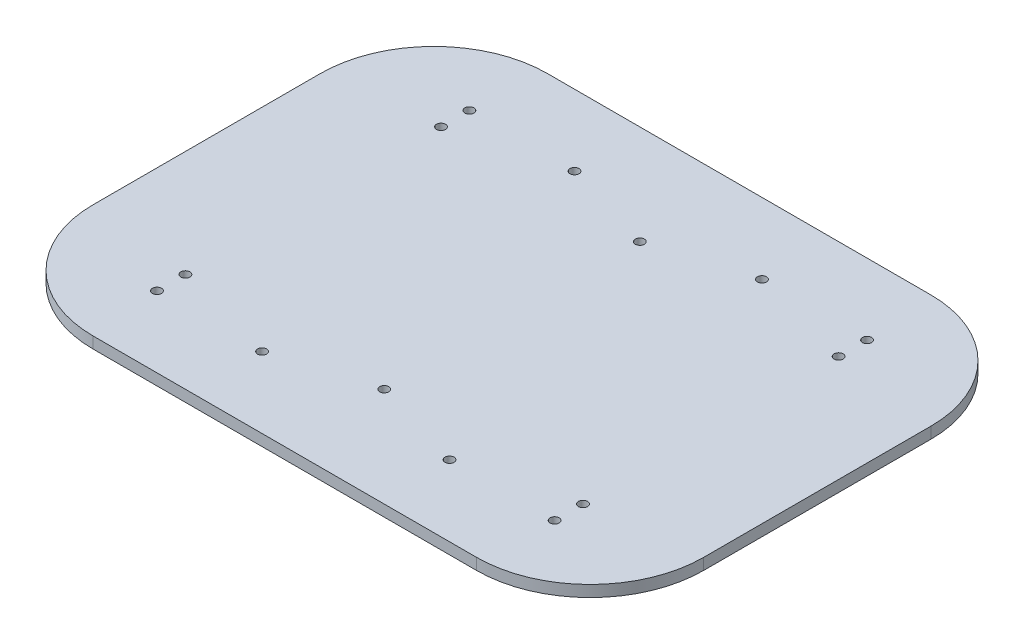
from build123d import *

# Parameters (mm, degrees)
SKETCH1_W                  = 215
SKETCH1_H                  = 160
BOSS_EXTRUDE1_DEPTH        = 4
F_1_0_3_2_DIAMETER_HOLE1_D = 3.2
FILLET1_R                  = 40
FILLET2_R                  = 40
SKETCH8_R                  = 1.6
CUT_EXTRUDE1_DEPTH         = 135.060620616


with BuildPart() as part:
    # Sketch1 → Boss-Extrude1 (new body)
    with BuildSketch(Plane(origin=(0, 0, 0), x_dir=(1, 0, 0), z_dir=(0, 1, 0))):
        Rectangle(SKETCH1_W, SKETCH1_H)
    extrude(amount=BOSS_EXTRUDE1_DEPTH)

    # Ø1.0 (3.2) Diameter Hole1 (through all)
    with Locations(Plane.XZ):
        with Locations((-70, 55), (33, 55), (-33, 55), (70, 55), (70, -55), (33, -55), (-33, -55), (-70, -55)):
            Hole(F_1_0_3_2_DIAMETER_HOLE1_D / 2)

    # Fillet1
    fillet1_edges = [part.edges().sort_by_distance(p)[0] for p in [
        (-107.5, 2, 80),
        (-107.5, 2, -80),
    ]]
    fillet(fillet1_edges, radius=FILLET1_R)

    # Fillet2
    fillet2_edges = [part.edges().sort_by_distance(p)[0] for p in [
        (107.5, 2, -80),
        (107.5, 2, 80),
    ]]
    fillet(fillet2_edges, radius=FILLET2_R)

    # Sketch8 → Cut-Extrude1 (cut, through all)
    with BuildSketch(Plane.XZ):
        with Locations(Location((-70, -45, 0), (0, 0, 270))):
            Circle(SKETCH8_R)
        with Locations(Location((0, -45, 0), (0, 0, 270))):
            Circle(SKETCH8_R)
        with Locations(Location((70, -45, 0), (0, 0, 270))):
            Circle(SKETCH8_R)
        with Locations(Location((70, 45, 0), (0, 0, 90))):
            Circle(SKETCH8_R)
        with Locations(Location((0, 45, 0), (0, 0, 90))):
            Circle(SKETCH8_R)
        with Locations(Location((-70, 45, 0), (0, 0, 90))):
            Circle(SKETCH8_R)
    extrude(amount=-CUT_EXTRUDE1_DEPTH, mode=Mode.SUBTRACT)


solid = part.part
